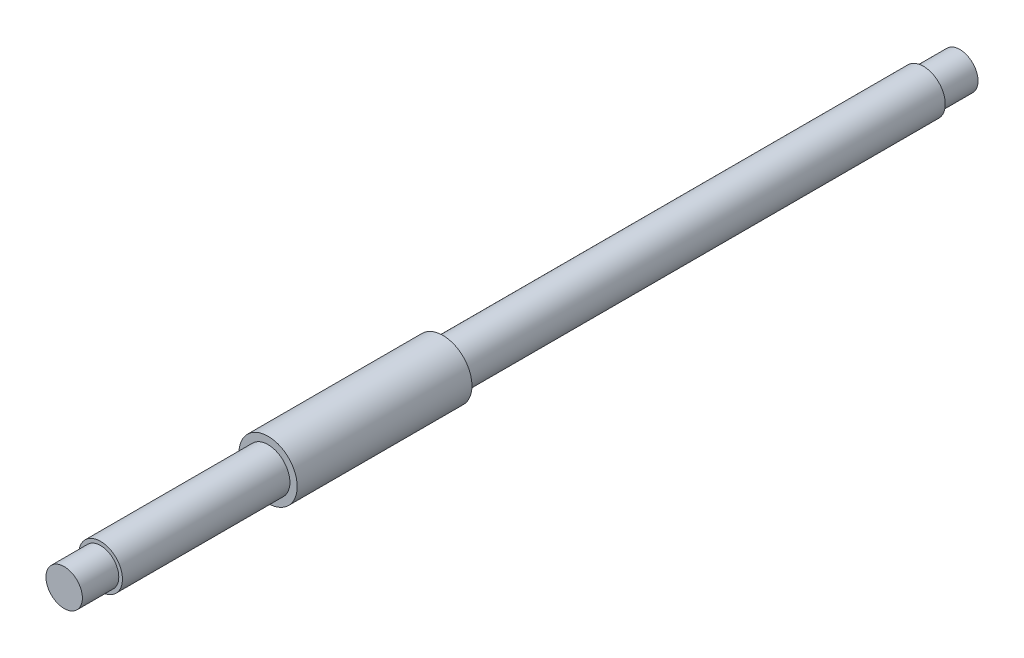
from build123d import *

# Parameters (mm, degrees)
SKETCH_1_R      = 4
EXTRUDE_1_DEPTH = 24
SKETCH_2_R      = 3
EXTRUDE_2_DEPTH = 23
EXTRUDE_START   = 66
SKETCH_3_R      = 3
EXTRUDE_3_DEPTH = 66
SKETCH_4_R      = 2.5
EXTRUDE_4_DEPTH = 5
EXTRUDE_START_2 = 5
SKETCH_6_R      = 2.5
EXTRUDE_5_DEPTH = 5


with BuildPart() as part:
    # 草图1 → 凸台-拉伸1 (new body)
    with BuildSketch(Plane.XY):
        Circle(SKETCH_1_R)
    extrude(amount=EXTRUDE_1_DEPTH)

    # 草图2 → 凸台-拉伸2 (add)
    with BuildSketch(Plane.XY.offset(24)):
        Circle(SKETCH_2_R)
    extrude(amount=EXTRUDE_2_DEPTH)

    # 草图3 → 凸台-拉伸3 (add)
    with BuildSketch(Plane(origin=(0, 0, 0), x_dir=(-1, 0, 0), z_dir=(0, 0, -1)).offset(EXTRUDE_START)):
        with Locations(Location((0, 0, 0), (0, 0, 180))):
            Circle(SKETCH_3_R)
    extrude(amount=-EXTRUDE_3_DEPTH)

    # 草图4 → 凸台-拉伸4 (add)
    with BuildSketch(Plane(origin=(0, 0, -66), x_dir=(-1, 0, 0), z_dir=(0, 0, -1))):
        Circle(SKETCH_4_R)
    extrude(amount=EXTRUDE_4_DEPTH)

    # 草图6 → 凸台-拉伸5 (add)
    with BuildSketch(Plane.XY.offset(47).offset(EXTRUDE_START_2)):
        with Locations(Location((0, 0, 0), (0, 0, 180))):
            Circle(SKETCH_6_R)
    extrude(amount=-EXTRUDE_5_DEPTH)


solid = part.part
